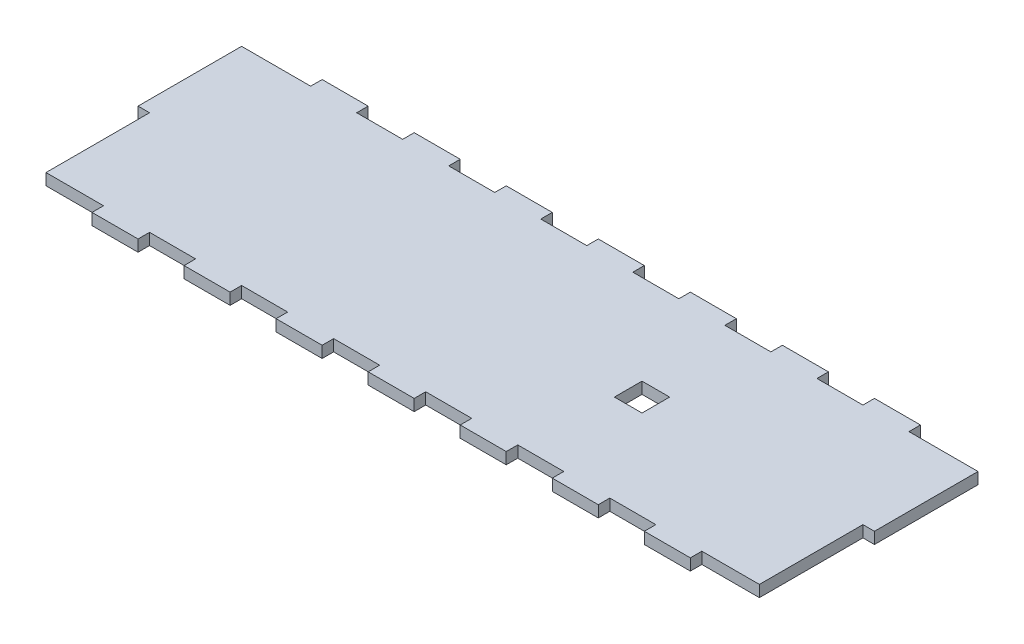
from build123d import *

# Parameters (mm, degrees)
SKETCH1_W           = 160
SKETCH1_H           = 50
BOSS_EXTRUDE1_DEPTH = 1.25
SKETCH2_W           = 10
SKETCH2_H           = 2.5
SKETCH2_W_2         = 15
CUT_EXTRUDE1_DEPTH  = 4
SKETCH3_W           = 2.5
SKETCH3_H           = 22.5
CUT_EXTRUDE2_DEPTH  = 84.852549156
CUT_EXTRUDE3_REACH  = 85.853
SKETCH4_W           = 6
SKETCH4_H           = 6


with BuildPart() as part:
    # Sketch1 → Boss-Extrude1 (new, symmetric)
    with BuildSketch(Plane(origin=(0, 0, 0), x_dir=(1, 0, 0), z_dir=(0, 1, 0))):
        Rectangle(SKETCH1_W, SKETCH1_H)
    extrude(amount=BOSS_EXTRUDE1_DEPTH, both=True)

    # Sketch2 → Cut-Extrude1 (cut)
    with BuildSketch(Plane(origin=(0, 1.25, 0), x_dir=(1, 0, 0), z_dir=(0, 1, 0))):
        with Locations((30, 23.75)):
            Rectangle(SKETCH2_W, SKETCH2_H)
        with Locations((10, 23.75)):
            Rectangle(SKETCH2_W, SKETCH2_H)
        with Locations((10, -23.75)):
            Rectangle(SKETCH2_W, SKETCH2_H)
        with Locations((30, -23.75)):
            Rectangle(SKETCH2_W, SKETCH2_H)
        with Locations((50, 23.75)):
            Rectangle(SKETCH2_W, SKETCH2_H)
        with Locations((50, -23.75)):
            Rectangle(SKETCH2_W, SKETCH2_H)
        with Locations((-10, 23.75)):
            Rectangle(SKETCH2_W, SKETCH2_H)
        with Locations((-10, -23.75)):
            Rectangle(SKETCH2_W, SKETCH2_H)
        with Locations((-30, 23.75)):
            Rectangle(SKETCH2_W, SKETCH2_H)
        with Locations((-30, -23.75)):
            Rectangle(SKETCH2_W, SKETCH2_H)
        with Locations((-50, 23.75)):
            Rectangle(SKETCH2_W, SKETCH2_H)
        with Locations((-50, -23.75)):
            Rectangle(SKETCH2_W, SKETCH2_H)
        with Locations((72.5, 23.75)):
            Rectangle(SKETCH2_W_2, SKETCH2_H)
        with Locations((72.5, -23.75)):
            Rectangle(SKETCH2_W_2, SKETCH2_H)
        with Locations((-72.5, 23.75)):
            Rectangle(SKETCH2_W_2, SKETCH2_H)
        with Locations((-72.5, -23.75)):
            Rectangle(SKETCH2_W_2, SKETCH2_H)
    extrude(amount=-CUT_EXTRUDE1_DEPTH, mode=Mode.SUBTRACT)

    # Sketch3 → Cut-Extrude2 (cut, through all)
    with BuildSketch(Plane(origin=(0, 1.25, 0), x_dir=(1, 0, 0), z_dir=(0, 1, 0))):
        with Locations((78.75, -11.25)):
            Rectangle(SKETCH3_W, SKETCH3_H)
        with Locations((-78.75, -11.25)):
            Rectangle(SKETCH3_W, SKETCH3_H)
    extrude(amount=-CUT_EXTRUDE2_DEPTH, mode=Mode.SUBTRACT)

    # Sketch4 → Cut-Extrude3 (cut, up to next)
    with BuildSketch(Plane(origin=(0, -1.25, 0), x_dir=(-1, 0, 0), z_dir=(0, -1, 0)), mode=Mode.PRIVATE) as cut_extrude3_sk1:
        with Locations((-29.5, 0)):
            Rectangle(SKETCH4_W, SKETCH4_H)
    cut_extrude3_tool1 = extrude(cut_extrude3_sk1.sketch, amount=-CUT_EXTRUDE3_REACH, mode=Mode.PRIVATE) & part.part
    add(cut_extrude3_tool1.solids().sort_by_distance((29.5, -1.25, 0))[0], mode=Mode.SUBTRACT)


solid = part.part
